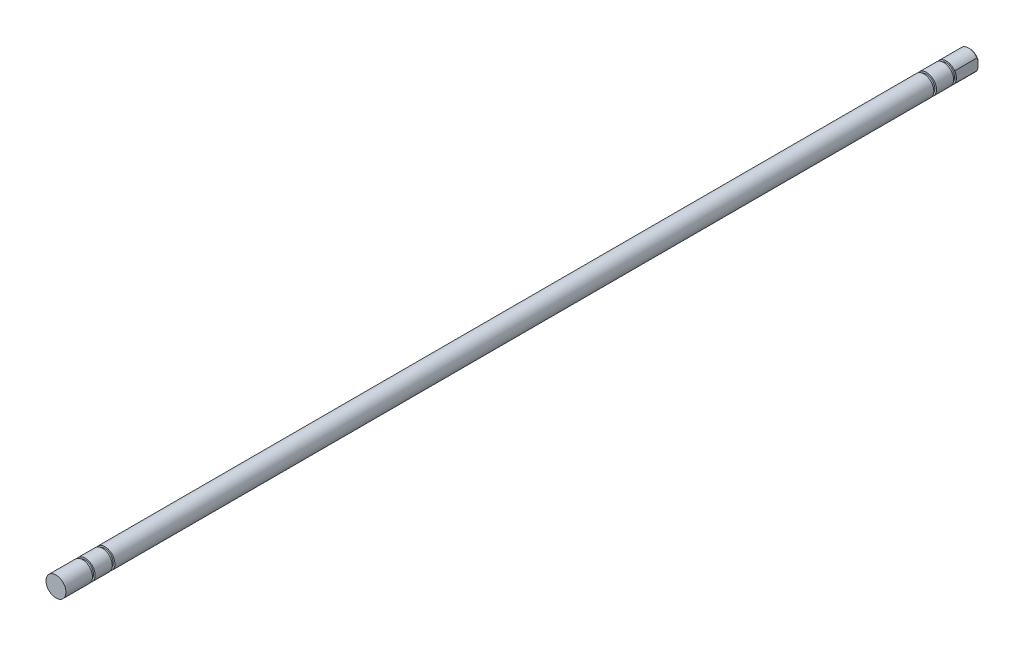
from build123d import *

# Parameters (mm, degrees)
SKETCH1_R               = 3
BOSS_EXTRUDE1_DEPTH     = 275
SKETCH3_W               = 0.8
SKETCH3_H               = 0.5
CUT_EXTRUDE2_DEPTH      = 276.032725326
CUT_EXTRUDE2_DEPTH_BACK = 276.032725326
SKETCH4_W               = 3.470061058
SKETCH4_H               = 7
SKETCH4_W_2             = 2.92528695
CHAMFER1_SIZE           = 0.3


with BuildPart() as part:
    # Sketch1 → Boss-Extrude1 (new body)
    with BuildSketch(Plane.XY):
        Circle(SKETCH1_R)
    extrude(amount=BOSS_EXTRUDE1_DEPTH)

    # Sketch3 → Cut-Revolve1 (revolve, cut)
    with BuildSketch(Plane(origin=(0, 0, 0), x_dir=(0, 0, -1), z_dir=(1, 0, 0)), mode=Mode.PRIVATE) as cut_revolve1_sk:
        with Locations((-266.6, 2.75)):
            Rectangle(SKETCH3_W, SKETCH3_H)
        with Locations((-260.65, 2.75)):
            Rectangle(SKETCH3_W, SKETCH3_H)
        with Locations((-13.4, 2.75)):
            Rectangle(SKETCH3_W, SKETCH3_H)
        with Locations((-7.45, 2.75)):
            Rectangle(SKETCH3_W, SKETCH3_H)
    revolve(cut_revolve1_sk.sketch.rotate(Axis((0, 0, 263.365004794), (0, 0, -1)), 90), axis=Axis((0, 0, 263.365004794), (0, 0, -1)), mode=Mode.SUBTRACT)

    # Sketch4 → Cut-Extrude2 (cut, two sides: drawn at the far end of the back side and taken through both)
    with BuildSketch(Plane(origin=(0, 0, 0), x_dir=(1, 0, 0), z_dir=(0, 1, 0)).offset(-CUT_EXTRUDE2_DEPTH_BACK)):
        with Locations((4.235030529, -3.5)):
            Rectangle(SKETCH4_W, SKETCH4_H)
        with Locations((-3.962643475, -3.5)):
            Rectangle(SKETCH4_W_2, SKETCH4_H)
    extrude(amount=CUT_EXTRUDE2_DEPTH + CUT_EXTRUDE2_DEPTH_BACK, mode=Mode.SUBTRACT)

    # Chamfer1
    chamfer1_edges = [part.edges().sort_by_distance(p)[0] for p in [
        (0, 3, 0),
        (0, -3, 0),
    ]]
    chamfer(chamfer1_edges, length=CHAMFER1_SIZE)


solid = part.part
